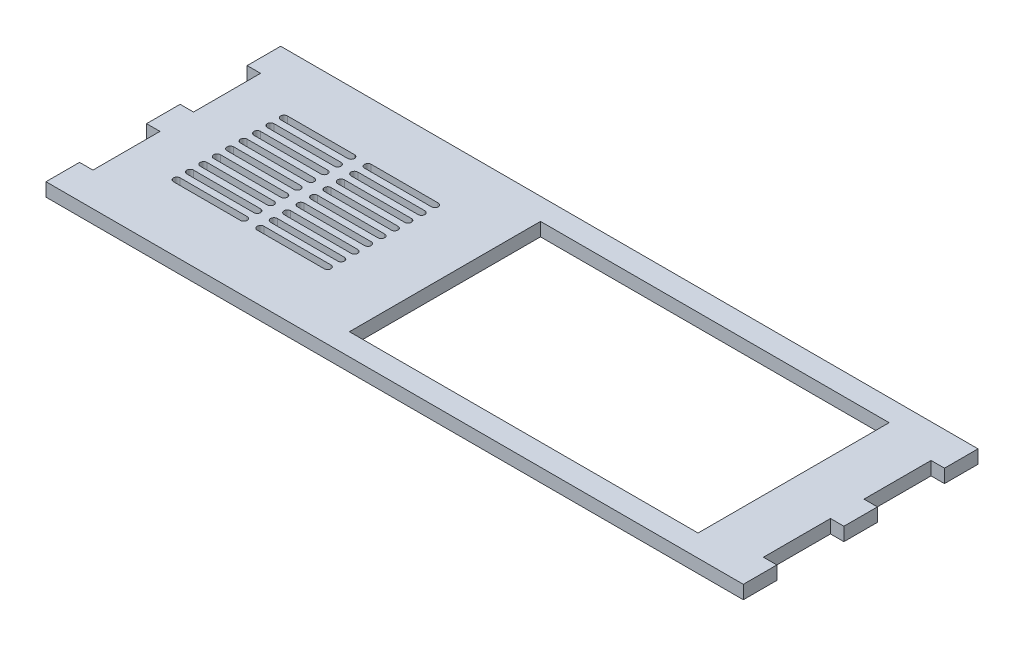
from build123d import *

# Parameters (mm, degrees)
SKETCH1_W           = 104
SKETCH1_H           = 57
SKETCH1_W_2         = 4
SKETCH1_H_2         = 10
BOSS_EXTRUDE1_DEPTH = 4


with BuildPart() as part:
    # Sketch1 → Boss-Extrude1 (new body)
    # profile 1 of 7: a face of its own
    with BuildSketch(Plane(origin=(0, 0, 0), x_dir=(1, 0, 0), z_dir=(0, 1, 0))):
        Polygon((0, 10), (0, 0), (200, 0), (200, 10), (200, 30), (200, 40), (200, 60), (200, 70), (0, 70), (0, 60), (0, 40), (0, 30), align=None)
        with BuildLine():
            ThreePointArc((35, 21), (36, 20), (35, 19))
            Line((35, 19), (15, 19))
            ThreePointArc((15, 19), (14, 20), (15, 21))
            Line((15, 21), (35, 21))
        make_face(mode=Mode.SUBTRACT)
        with BuildLine():
            ThreePointArc((35, 25), (36, 24), (35, 23))
            Line((35, 23), (15, 23))
            ThreePointArc((15, 23), (14, 24), (15, 25))
            Line((15, 25), (35, 25))
        make_face(mode=Mode.SUBTRACT)
        with BuildLine():
            ThreePointArc((35, 29), (36, 28), (35, 27))
            Line((35, 27), (15, 27))
            ThreePointArc((15, 27), (14, 28), (15, 29))
            Line((15, 29), (35, 29))
        make_face(mode=Mode.SUBTRACT)
        with BuildLine():
            ThreePointArc((35, 33), (36, 32), (35, 31))
            Line((35, 31), (15, 31))
            ThreePointArc((15, 31), (14, 32), (15, 33))
            Line((15, 33), (35, 33))
        make_face(mode=Mode.SUBTRACT)
        with BuildLine():
            ThreePointArc((60, 21), (61, 20), (60, 19))
            Line((60, 19), (40, 19))
            ThreePointArc((40, 19), (39, 20), (40, 21))
            Line((40, 21), (60, 21))
        make_face(mode=Mode.SUBTRACT)
        with BuildLine():
            ThreePointArc((60, 25), (61, 24), (60, 23))
            Line((60, 23), (40, 23))
            ThreePointArc((40, 23), (39, 24), (40, 25))
            Line((40, 25), (60, 25))
        make_face(mode=Mode.SUBTRACT)
        with BuildLine():
            ThreePointArc((60, 29), (61, 28), (60, 27))
            Line((60, 27), (40, 27))
            ThreePointArc((40, 27), (39, 28), (40, 29))
            Line((40, 29), (60, 29))
        make_face(mode=Mode.SUBTRACT)
        with BuildLine():
            ThreePointArc((60, 33), (61, 32), (60, 31))
            Line((60, 31), (40, 31))
            ThreePointArc((40, 31), (39, 32), (40, 33))
            Line((40, 33), (60, 33))
        make_face(mode=Mode.SUBTRACT)
        with BuildLine():
            ThreePointArc((35, 37), (36, 36), (35, 35))
            Line((35, 35), (15, 35))
            ThreePointArc((15, 35), (14, 36), (15, 37))
            Line((15, 37), (35, 37))
        make_face(mode=Mode.SUBTRACT)
        with BuildLine():
            ThreePointArc((35, 41), (36, 40), (35, 39))
            Line((35, 39), (15, 39))
            ThreePointArc((15, 39), (14, 40), (15, 41))
            Line((15, 41), (35, 41))
        make_face(mode=Mode.SUBTRACT)
        with BuildLine():
            ThreePointArc((35, 45), (36, 44), (35, 43))
            Line((35, 43), (15, 43))
            ThreePointArc((15, 43), (14, 44), (15, 45))
            Line((15, 45), (35, 45))
        make_face(mode=Mode.SUBTRACT)
        with BuildLine():
            ThreePointArc((35, 49), (36, 48), (35, 47))
            Line((35, 47), (15, 47))
            ThreePointArc((15, 47), (14, 48), (15, 49))
            Line((15, 49), (35, 49))
        make_face(mode=Mode.SUBTRACT)
        with BuildLine():
            ThreePointArc((35, 53), (36, 52), (35, 51))
            Line((35, 51), (15, 51))
            ThreePointArc((15, 51), (14, 52), (15, 53))
            Line((15, 53), (35, 53))
        make_face(mode=Mode.SUBTRACT)
        with BuildLine():
            ThreePointArc((60, 37), (61, 36), (60, 35))
            Line((60, 35), (40, 35))
            ThreePointArc((40, 35), (39, 36), (40, 37))
            Line((40, 37), (60, 37))
        make_face(mode=Mode.SUBTRACT)
        with BuildLine():
            ThreePointArc((60, 41), (61, 40), (60, 39))
            Line((60, 39), (40, 39))
            ThreePointArc((40, 39), (39, 40), (40, 41))
            Line((40, 41), (60, 41))
        make_face(mode=Mode.SUBTRACT)
        with BuildLine():
            ThreePointArc((60, 45), (61, 44), (60, 43))
            Line((60, 43), (40, 43))
            ThreePointArc((40, 43), (39, 44), (40, 45))
            Line((40, 45), (60, 45))
        make_face(mode=Mode.SUBTRACT)
        with BuildLine():
            ThreePointArc((60, 49), (61, 48), (60, 47))
            Line((60, 47), (40, 47))
            ThreePointArc((40, 47), (39, 48), (40, 49))
            Line((40, 49), (60, 49))
        make_face(mode=Mode.SUBTRACT)
        with BuildLine():
            ThreePointArc((60, 53), (61, 52), (60, 51))
            Line((60, 51), (40, 51))
            ThreePointArc((40, 51), (39, 52), (40, 53))
            Line((40, 53), (60, 53))
        make_face(mode=Mode.SUBTRACT)
        with Locations((132, 35)):
            Rectangle(SKETCH1_W, SKETCH1_H, mode=Mode.SUBTRACT)
    # profile 2 of 7: a face of its own
    with BuildSketch(Plane(origin=(0, 0, 0), x_dir=(1, 0, 0), z_dir=(0, 1, 0))):
        with Locations((-2, 5)):
            Rectangle(SKETCH1_W_2, SKETCH1_H_2)
    # profile 3 of 7: a face of its own
    with BuildSketch(Plane(origin=(0, 0, 0), x_dir=(1, 0, 0), z_dir=(0, 1, 0))):
        with Locations((202, 5)):
            Rectangle(SKETCH1_W_2, SKETCH1_H_2)
    # profile 4 of 7: a face of its own
    with BuildSketch(Plane(origin=(0, 0, 0), x_dir=(1, 0, 0), z_dir=(0, 1, 0))):
        with Locations((-2, 35)):
            Rectangle(SKETCH1_W_2, SKETCH1_H_2)
    # profile 5 of 7: a face of its own
    with BuildSketch(Plane(origin=(0, 0, 0), x_dir=(1, 0, 0), z_dir=(0, 1, 0))):
        with Locations((202, 35)):
            Rectangle(SKETCH1_W_2, SKETCH1_H_2)
    # profile 6 of 7: a face of its own
    with BuildSketch(Plane(origin=(0, 0, 0), x_dir=(1, 0, 0), z_dir=(0, 1, 0))):
        with Locations((-2, 65)):
            Rectangle(SKETCH1_W_2, SKETCH1_H_2)
    # profile 7 of 7: a face of its own
    with BuildSketch(Plane(origin=(0, 0, 0), x_dir=(1, 0, 0), z_dir=(0, 1, 0))):
        with Locations((202, 65)):
            Rectangle(SKETCH1_W_2, SKETCH1_H_2)
    extrude(amount=BOSS_EXTRUDE1_DEPTH)


solid = part.part
